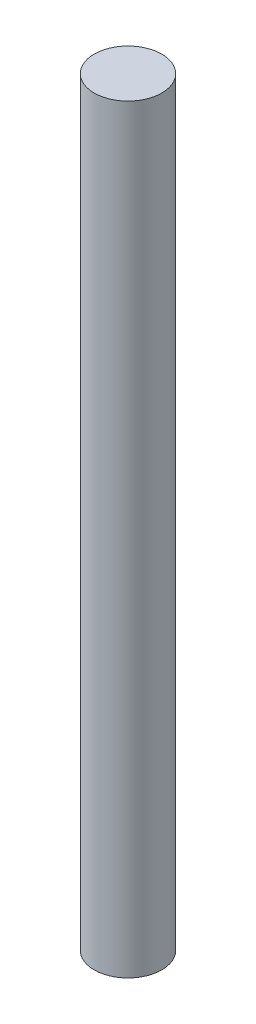
from build123d import *

# Parameters (mm, degrees)
SKETCH1_R           = 1.016
BOSS_EXTRUDE1_DEPTH = 22.86


with BuildPart() as part:
    # Sketch1 → Boss-Extrude1 (new body)
    with BuildSketch(Plane(origin=(0, 0, 0), x_dir=(1, 0, 0), z_dir=(0, 1, 0))):
        with Locations(Location((0, 0, 0), (0, 0, 270))):
            Circle(SKETCH1_R)
    extrude(amount=BOSS_EXTRUDE1_DEPTH)


solid = part.part
